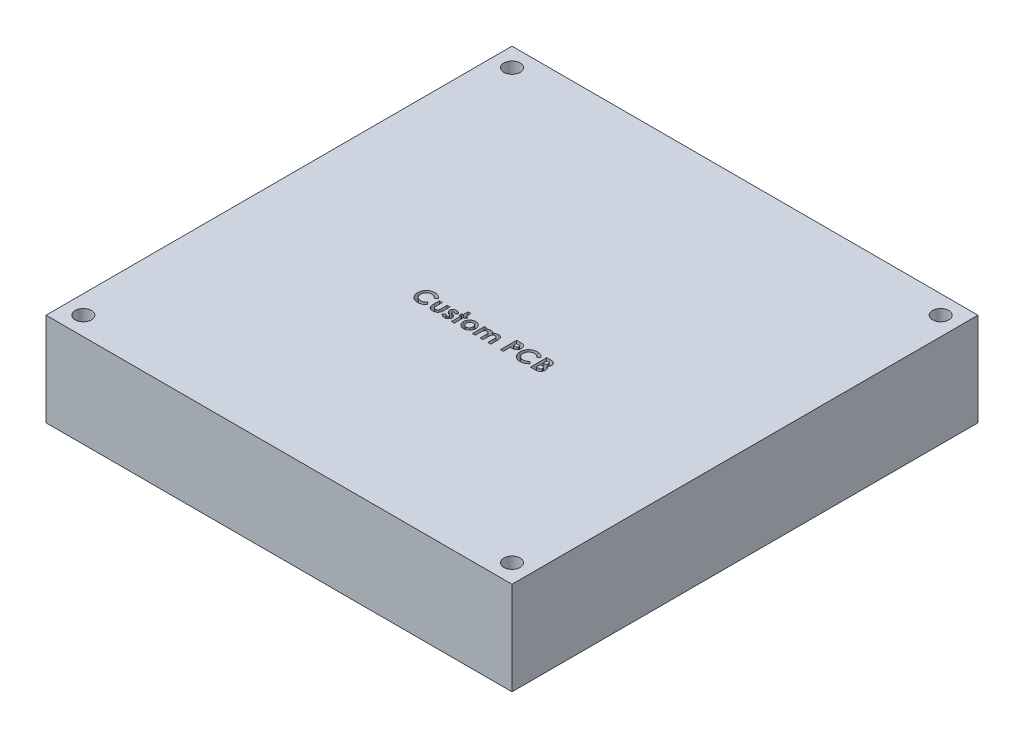
from build123d import *

# Parameters (mm, degrees)
SKETCH1_W           = 100
SKETCH1_H           = 100
SKETCH1_R           = 1.75
BOSS_EXTRUDE1_DEPTH = 20
CUT_EXTRUDE1_DEPTH  = 2


with BuildPart() as part:
    # Sketch1 → Boss-Extrude1 (new body)
    with BuildSketch(Plane(origin=(0, 0, 0), x_dir=(1, 0, 0), z_dir=(0, 1, 0))):
        with Locations((-50, 50)):
            Rectangle(SKETCH1_W, SKETCH1_H)
        with Locations(Location((-96, 96, 0), (0, 0, 270))):
            Circle(SKETCH1_R, mode=Mode.SUBTRACT)
        with Locations(Location((-96, 4, 0), (0, 0, 270))):
            Circle(SKETCH1_R, mode=Mode.SUBTRACT)
        with Locations(Location((-4, 4, 0), (0, 0, 270))):
            Circle(SKETCH1_R, mode=Mode.SUBTRACT)
        with Locations(Location((-4, 96, 0), (0, 0, 270))):
            Circle(SKETCH1_R, mode=Mode.SUBTRACT)
    extrude(amount=BOSS_EXTRUDE1_DEPTH)

    # Sketch2 → Cut-Extrude1 (cut)
    # profile 1 of 9: a face of its own
    with BuildSketch(Plane(origin=(0, 20, 0), x_dir=(1, 0, 0), z_dir=(0, 1, 0))):
        with BuildLine():
            Line((-60.993589744, 45.226903254), (-61.454226763, 44.786598767))
            add(Edge.make_bspline(
                [(-61.454226763, 44.786598767), (-61.493301748, 44.827002367), (-61.569627434, 44.905923255), (-61.692616839, 45.010407556), (-61.820521342, 45.097481083), (-61.950852817, 45.170813854), (-62.085955548, 45.226295321), (-62.22426738, 45.266725601), (-62.366671475, 45.291374414), (-62.46304509, 45.294194675), (-62.511518429, 45.29561319)],
                knots=[0, 0, 0, 0, 1.115251505, 2.178435587, 3.19620269, 4.182487026, 5.141301733, 6.088180966, 7.038406374, 8, 8, 8, 8], degree=3))
            add(Edge.make_bspline(
                [(-62.511518429, 45.29561319), (-62.551999559, 45.294492514), (-62.631884607, 45.292280982), (-62.749176792, 45.276068272), (-62.861372829, 45.248497852), (-62.968856782, 45.210500708), (-63.071312376, 45.161334419), (-63.168954421, 45.10103704), (-63.261542184, 45.030153142), (-63.347852636, 44.949049481), (-63.426806405, 44.860437636), (-63.496567086, 44.76588901), (-63.555002847, 44.665620206), (-63.602960125, 44.560646675), (-63.640316992, 44.450482547), (-63.666994487, 44.335201988), (-63.682424038, 44.214667709), (-63.684727002, 44.132729404), (-63.685897436, 44.091085947)],
                knots=[0, 0, 0, 0, 1.035432265, 2.043311493, 3.022114605, 3.98653278, 4.95457646, 5.923598177, 6.917315552, 7.932509744, 8.948865224, 9.949768934, 10.933144597, 11.912367597, 12.897413939, 13.903909035, 14.934704909, 16, 16, 16, 16], degree=3))
            add(Edge.make_bspline(
                [(-63.685897436, 44.091085947), (-63.68556013, 44.061857655), (-63.684895294, 44.004248091), (-63.677617482, 43.919027557), (-63.66589849, 43.836343492), (-63.648938205, 43.756321141), (-63.627729201, 43.678891154), (-63.602846211, 43.603385548), (-63.571630865, 43.530847641), (-63.536981361, 43.46043495), (-63.496684386, 43.394068776), (-63.453236814, 43.33078312), (-63.406125016, 43.270888204), (-63.355043845, 43.214628879), (-63.299274398, 43.162884353), (-63.240258109, 43.114098606), (-63.176999455, 43.069492911), (-63.110812477, 43.027947838), (-63.041125405, 42.99185728), (-62.969829011, 42.959166207), (-62.895842296, 42.932616196), (-62.820066094, 42.911214464), (-62.742771202, 42.893015488), (-62.663201605, 42.881809819), (-62.582047071, 42.873323896), (-62.527200228, 42.87279994), (-62.499599359, 42.872536267)],
                knots=[0, 0, 0, 0, 1.103660481, 2.175337485, 3.227646561, 4.255952547, 5.262355991, 6.258840057, 7.255597736, 8.242457506, 9.22035537, 10.185017736, 11.140346927, 12.096287581, 13.051739095, 14.01125915, 14.986044842, 15.97314143, 16.960198552, 17.947847494, 18.933482797, 19.925264591, 20.920966487, 21.929612487, 22.958107872, 24, 24, 24, 24], degree=3))
            add(Edge.make_bspline(
                [(-62.499599359, 42.872536267), (-62.452783542, 42.873890429), (-62.360802636, 42.876551005), (-62.22580743, 42.897356332), (-62.097170448, 42.931579918), (-61.994390115, 42.971995984), (-61.913864438, 43.011907373), (-61.852561431, 43.048823444), (-61.789169344, 43.090118121), (-61.724741065, 43.137349912), (-61.658551904, 43.189952016), (-61.591770252, 43.249076517), (-61.522686487, 43.31277653), (-61.477430398, 43.358240481), (-61.454226763, 43.38155069)],
                knots=[0, 0, 0, 0, 1.404581149, 2.759636711, 4.088442092, 5.392261763, 6.066678138, 6.783632037, 7.538459478, 8.336747902, 9.180226004, 10.074962426, 11.012997595, 12, 12, 12, 12], degree=3))
            Line((-61.454226763, 43.38155069), (-61.007612179, 42.912500209))
            add(Edge.make_bspline(
                [(-61.007612179, 42.912500209), (-61.039006781, 42.882189708), (-61.100282328, 42.82303009), (-61.192714791, 42.739028953), (-61.285030924, 42.663544594), (-61.375000561, 42.593837261), (-61.4640975, 42.531937697), (-61.552312291, 42.477784084), (-61.638646305, 42.430006797), (-61.724892294, 42.389411578), (-61.811586927, 42.35494202), (-61.900785516, 42.325265993), (-61.99276075, 42.300161143), (-62.088074372, 42.279904825), (-62.185837353, 42.263661993), (-62.286964627, 42.252698175), (-62.390814995, 42.245327565), (-62.461258309, 42.244665255), (-62.496794872, 42.244331139)],
                knots=[0, 0, 0, 0, 1.244526981, 2.429050516, 3.560637417, 4.644440555, 5.67424972, 6.652764056, 7.595344123, 8.486817594, 9.369275933, 10.254498637, 11.166417451, 12.086725134, 13.032340136, 13.991389299, 14.986715468, 16, 16, 16, 16], degree=3))
            add(Edge.make_bspline(
                [(-62.496794872, 42.244331139), (-62.562071136, 42.245995161), (-62.68979864, 42.24925119), (-62.876979966, 42.273376159), (-63.054797202, 42.313821244), (-63.223682943, 42.37102175), (-63.383583487, 42.444092716), (-63.534457927, 42.53367429), (-63.676063088, 42.639528466), (-63.807255077, 42.760414532), (-63.925924474, 42.893923043), (-64.03081448, 43.037274557), (-64.117579496, 43.191173595), (-64.189622358, 43.353346575), (-64.245958929, 43.524533556), (-64.285610324, 43.704919711), (-64.310063051, 43.894330865), (-64.312738214, 44.02370305), (-64.314102564, 44.089683703)],
                knots=[0, 0, 0, 0, 1.078019885, 2.10938526, 3.111377082, 4.085535484, 5.04941344, 6.010039228, 6.978205633, 7.964457913, 8.951525778, 9.924444315, 10.892603023, 11.863865945, 12.85144698, 13.863884204, 14.910567087, 16, 16, 16, 16], degree=3))
            add(Edge.make_bspline(
                [(-64.314102564, 44.089683703), (-64.313526056, 44.132715722), (-64.312383557, 44.217994667), (-64.30037579, 44.343617461), (-64.283636264, 44.466077216), (-64.257080528, 44.584102391), (-64.225070208, 44.699283006), (-64.185261169, 44.81036718), (-64.137716992, 44.91767418), (-64.083970137, 45.021383646), (-64.023166858, 45.120816169), (-63.955242921, 45.215117466), (-63.881946952, 45.305015527), (-63.801517769, 45.389317687), (-63.715124113, 45.468764136), (-63.622375927, 45.542924337), (-63.523831044, 45.612861832), (-63.419222741, 45.676773102), (-63.310583278, 45.734584243), (-63.199282884, 45.785576138), (-63.085595012, 45.82819362), (-62.970000344, 45.863543249), (-62.852010494, 45.889929248), (-62.732467644, 45.909902598), (-62.610354628, 45.921067828), (-62.528366316, 45.922895647), (-62.486979167, 45.923818318)],
                knots=[0, 0, 0, 0, 1.071919942, 2.124283339, 3.142214191, 4.149696895, 5.136002878, 6.119640489, 7.086990633, 8.058538607, 9.028339693, 9.988281803, 10.952401235, 11.916291999, 12.888973767, 13.874849856, 14.873389453, 15.898127285, 16.927174885, 17.938320013, 18.946391617, 19.950418109, 20.947802303, 21.956882652, 22.968648068, 24, 24, 24, 24], degree=3))
            add(Edge.make_bspline(
                [(-62.486979167, 45.923818318), (-62.451671684, 45.92328942), (-62.381423819, 45.922237123), (-62.276812961, 45.913465083), (-62.17303873, 45.899688682), (-62.070472672, 45.878903027), (-61.968381129, 45.854227828), (-61.868105698, 45.821919058), (-61.768064481, 45.785904845), (-61.669826474, 45.742857208), (-61.573254552, 45.695866823), (-61.480611065, 45.642554525), (-61.390340537, 45.586201094), (-61.304443309, 45.523471285), (-61.22131034, 45.456640426), (-61.141376341, 45.385396713), (-61.065342778, 45.308552305), (-61.017628335, 45.254257195), (-60.993589744, 45.226903254)],
                knots=[0, 0, 0, 0, 0.996412454, 1.982464992, 2.961075852, 3.949442424, 4.934965278, 5.923860011, 6.921385422, 7.934793307, 8.949617135, 9.951082467, 10.950285876, 11.951772932, 12.951063433, 13.960125323, 14.972308753, 16, 16, 16, 16], degree=3))
        make_face()
    # profile 2 of 9: a face of its own
    with BuildSketch(Plane(origin=(0, 20, 0), x_dir=(1, 0, 0), z_dir=(0, 1, 0))):
        with BuildLine():
            Line((-60.455128205, 44.891767036), (-59.826923077, 44.891767036))
            Line((-59.826923077, 44.891767036), (-59.826923077, 43.664102774))
            add(Edge.make_bspline(
                [(-59.826923077, 43.664102774), (-59.826867292, 43.63535384), (-59.826760227, 43.580177615), (-59.82378096, 43.500933755), (-59.819600458, 43.428468873), (-59.814383476, 43.362697521), (-59.806596795, 43.3037779), (-59.797607399, 43.251822489), (-59.787416326, 43.206456945), (-59.770844352, 43.155890997), (-59.744917201, 43.100556292), (-59.705762613, 43.041812004), (-59.658334987, 42.991015373), (-59.603275102, 42.947715602), (-59.540020661, 42.913594433), (-59.469443144, 42.890471036), (-59.392430561, 42.87492971), (-59.338791413, 42.873355108), (-59.310897436, 42.872536267)],
                knots=[0, 0, 0, 0, 1.267339619, 2.432334223, 3.495366327, 4.467371443, 5.340232306, 6.114347373, 6.791623365, 7.387877112, 8.457231658, 9.474542289, 10.487879852, 11.508108106, 12.54995813, 13.638205937, 14.771795776, 16, 16, 16, 16], degree=3))
            add(Edge.make_bspline(
                [(-59.310897436, 42.872536267), (-59.283028212, 42.873470858), (-59.229250344, 42.875274292), (-59.151725367, 42.889337949), (-59.080981613, 42.913436493), (-59.016292498, 42.946123324), (-58.959565709, 42.98986908), (-58.910176014, 43.041995252), (-58.86859105, 43.103342699), (-58.848607557, 43.149106136), (-58.838341346, 43.172616395)],
                knots=[0, 0, 0, 0, 1.116871431, 2.155171802, 3.144773418, 4.104381479, 5.046960687, 6.001340237, 6.973219418, 8, 8, 8, 8], degree=3))
            add(Edge.make_bspline(
                [(-58.838341346, 43.172616395), (-58.834573992, 43.183059863), (-58.826257991, 43.206112614), (-58.818856586, 43.245881782), (-58.81089047, 43.292783077), (-58.80458899, 43.347772307), (-58.80102339, 43.410508918), (-58.797203214, 43.481071982), (-58.795256384, 43.55939122), (-58.795003917, 43.614322379), (-58.794871795, 43.64306912)],
                knots=[0, 0, 0, 0, 0.56094539, 1.238222264, 2.041156151, 2.969685991, 4.036367568, 5.220421584, 6.545382566, 8, 8, 8, 8], degree=3))
            Line((-58.794871795, 43.64306912), (-58.794871795, 44.891767036))
            Line((-58.794871795, 44.891767036), (-58.166666667, 44.891767036))
            Line((-58.166666667, 44.891767036), (-58.166666667, 43.816947325))
            add(Edge.make_bspline(
                [(-58.166666667, 43.816947325), (-58.16677544, 43.763655484), (-58.166983991, 43.661478896), (-58.172960933, 43.514909901), (-58.181209792, 43.38164943), (-58.191832734, 43.261330575), (-58.207139081, 43.153903403), (-58.225928438, 43.059619834), (-58.246715466, 42.977856829), (-58.265777945, 42.929411684), (-58.274639423, 42.906891235)],
                knots=[0, 0, 0, 0, 1.388070971, 2.661352173, 3.82033814, 4.865898334, 5.806910977, 6.645039373, 7.370126333, 8, 8, 8, 8], degree=3))
            add(Edge.make_bspline(
                [(-58.274639423, 42.906891235), (-58.285997555, 42.882652274), (-58.308417533, 42.834806648), (-58.347320361, 42.766780764), (-58.389259789, 42.702331628), (-58.436231311, 42.642976309), (-58.487276092, 42.588111557), (-58.540951257, 42.536490162), (-58.599674056, 42.490214225), (-58.661921591, 42.448092935), (-58.728562438, 42.410702221), (-58.799140158, 42.377567716), (-58.874417454, 42.35060191), (-58.953741584, 42.327744586), (-59.037478178, 42.310698704), (-59.125458561, 42.297787749), (-59.217779225, 42.291115318), (-59.280740208, 42.28985084), (-59.313000801, 42.289202934)],
                knots=[0, 0, 0, 0, 0.997311338, 1.968606903, 2.91805772, 3.860812155, 4.785445165, 5.709667791, 6.633356648, 7.568312411, 8.508286151, 9.478643871, 10.470653671, 11.485274776, 12.552984541, 13.653035246, 14.797438149, 16, 16, 16, 16], degree=3))
            add(Edge.make_bspline(
                [(-59.313000801, 42.289202934), (-59.347851308, 42.28961826), (-59.416041931, 42.290430912), (-59.515667479, 42.300382718), (-59.610611965, 42.313259061), (-59.699815341, 42.335151205), (-59.784523373, 42.360514348), (-59.863763565, 42.392884465), (-59.937859711, 42.430942551), (-60.006957608, 42.474462976), (-60.070521355, 42.52384456), (-60.129964365, 42.576952733), (-60.183367561, 42.635900503), (-60.232474341, 42.698867539), (-60.276736645, 42.766433358), (-60.316176442, 42.838357715), (-60.35082714, 42.914967759), (-60.369315006, 42.968660462), (-60.378705929, 42.995933703)],
                knots=[0, 0, 0, 0, 1.211240017, 2.369985978, 3.478996442, 4.539426614, 5.559871561, 6.551301256, 7.510778031, 8.453136967, 9.386094087, 10.30661716, 11.221130616, 12.147659962, 13.080758632, 14.026335491, 14.997475882, 16, 16, 16, 16], degree=3))
            add(Edge.make_bspline(
                [(-60.378705929, 42.995933703), (-60.385112723, 43.017115146), (-60.398914451, 43.062744913), (-60.413816088, 43.13857626), (-60.42573496, 43.225976132), (-60.437329261, 43.325030502), (-60.445417658, 43.435905432), (-60.45070433, 43.558424839), (-60.454276371, 43.692828309), (-60.454835895, 43.786329199), (-60.455128205, 43.835176492)],
                knots=[0, 0, 0, 0, 0.627914866, 1.352675004, 2.190563461, 3.132055958, 4.183353232, 5.345633452, 6.613289997, 8, 8, 8, 8], degree=3))
            Line((-60.455128205, 43.835176492), (-60.455128205, 44.891767036))
        make_face()
    # profile 3 of 9: a face of its own
    with BuildSketch(Plane(origin=(0, 20, 0), x_dir=(1, 0, 0), z_dir=(0, 1, 0))):
        with BuildLine():
            Line((-55.967948718, 44.497035466), (-56.352163462, 44.084074729))
            add(Edge.make_bspline(
                [(-56.352163462, 44.084074729), (-56.371349144, 44.105304727), (-56.408044088, 44.145909671), (-56.4642205, 44.201263286), (-56.519560336, 44.247356495), (-56.573032341, 44.286076712), (-56.625728607, 44.31577049), (-56.677211107, 44.337134498), (-56.727504543, 44.350696688), (-56.760841159, 44.352452262), (-56.777043269, 44.353305498)],
                knots=[0, 0, 0, 0, 1.327646587, 2.539285, 3.655602211, 4.666613517, 5.598770349, 6.454635452, 7.248928967, 8, 8, 8, 8], degree=3))
            add(Edge.make_bspline(
                [(-56.777043269, 44.353305498), (-56.793438177, 44.352805837), (-56.824829326, 44.351849143), (-56.869129271, 44.343643102), (-56.908049736, 44.329436933), (-56.940983342, 44.310072601), (-56.967442785, 44.286217732), (-56.985968275, 44.258928325), (-56.998408311, 44.229053145), (-56.999460658, 44.20783165), (-57, 44.196955338)],
                knots=[0, 0, 0, 0, 1.295068245, 2.479652818, 3.543291146, 4.55379989, 5.481948265, 6.332409746, 7.145336708, 8, 8, 8, 8], degree=3))
            add(Edge.make_bspline(
                [(-57, 44.196955338), (-56.998172659, 44.180473024), (-56.994381138, 44.146274136), (-56.968338649, 44.106608529), (-56.933882556, 44.077348023), (-56.894164643, 44.050119442), (-56.840376307, 44.019674973), (-56.79957111, 43.998828756), (-56.777043269, 43.987319921)],
                knots=[0, 0, 0, 0, 0.916701701, 1.902049539, 2.5493345, 3.440293453, 4.586830489, 6, 6, 6, 6], degree=3))
            Line((-56.777043269, 43.987319921), (-56.549879808, 43.872335947))
            add(Edge.make_bspline(
                [(-56.549879808, 43.872335947), (-56.520980272, 43.857661701), (-56.464909744, 43.829190908), (-56.386079834, 43.783249461), (-56.313271273, 43.738719711), (-56.247944579, 43.693082732), (-56.18969991, 43.647131391), (-56.138950975, 43.60041129), (-56.094466858, 43.554403544), (-56.044860823, 43.492719735), (-55.995239899, 43.41056192), (-55.953871461, 43.303719509), (-55.92749131, 43.18931478), (-55.924572651, 43.110130905), (-55.923076923, 43.069551492)],
                knots=[0, 0, 0, 0, 1.076693506, 2.088987655, 3.030641824, 3.911722491, 4.735175175, 5.493635918, 6.202154166, 6.859459289, 8.120623445, 9.372284821, 10.653373066, 12, 12, 12, 12], degree=3))
            add(Edge.make_bspline(
                [(-55.923076923, 43.069551492), (-55.923978108, 43.042174894), (-55.925741967, 42.988591627), (-55.936892712, 42.909722167), (-55.956922337, 42.834728988), (-55.983281293, 42.762443096), (-56.018786016, 42.69417164), (-56.06189049, 42.629583664), (-56.111914079, 42.567831163), (-56.170179229, 42.511026569), (-56.234007725, 42.458085309), (-56.304963871, 42.413557908), (-56.379910293, 42.374408088), (-56.460826958, 42.343835565), (-56.546578504, 42.319049371), (-56.637899998, 42.30187316), (-56.734481569, 42.29106373), (-56.80061771, 42.289833732), (-56.834535256, 42.289202934)],
                knots=[0, 0, 0, 0, 0.976600749, 1.911466839, 2.833459288, 3.740827163, 4.650527853, 5.570709661, 6.506801416, 7.479409329, 8.468875524, 9.458587492, 10.461481786, 11.480119772, 12.538142914, 13.641687514, 14.790552763, 16, 16, 16, 16], degree=3))
            add(Edge.make_bspline(
                [(-56.834535256, 42.289202934), (-56.879473092, 42.290633954), (-56.967682108, 42.293442921), (-57.096504989, 42.313009785), (-57.218147989, 42.346880354), (-57.332711186, 42.39432869), (-57.440896264, 42.454790877), (-57.541158218, 42.529811216), (-57.635235181, 42.617435111), (-57.689970135, 42.684638557), (-57.717948718, 42.718990594)],
                knots=[0, 0, 0, 0, 1.056901255, 2.07460411, 3.05625841, 4.019970729, 4.984811261, 5.963335951, 6.958928997, 8, 8, 8, 8], degree=3))
            Line((-57.717948718, 42.718990594), (-57.337239583, 43.141767036))
            add(Edge.make_bspline(
                [(-57.337239583, 43.141767036), (-57.318690149, 43.122202153), (-57.281863454, 43.083359461), (-57.219788529, 43.032140119), (-57.154108861, 42.985457457), (-57.08409328, 42.946259253), (-57.014063552, 42.914608467), (-56.946875805, 42.89086595), (-56.883796268, 42.875945381), (-56.842783579, 42.873633553), (-56.823317308, 42.872536267)],
                knots=[0, 0, 0, 0, 1.087861918, 2.159761696, 3.243809206, 4.338405912, 5.394481878, 6.343674753, 7.213841449, 8, 8, 8, 8], degree=3))
            add(Edge.make_bspline(
                [(-56.823317308, 42.872536267), (-56.803861574, 42.873099718), (-56.766462283, 42.874182827), (-56.713308207, 42.885449281), (-56.6661953, 42.904389855), (-56.626241801, 42.930651441), (-56.593009549, 42.960795731), (-56.569593799, 42.995054893), (-56.554110065, 43.031382645), (-56.552228199, 43.056781626), (-56.551282051, 43.069551492)],
                knots=[0, 0, 0, 0, 1.255011871, 2.412479185, 3.488767498, 4.514443302, 5.48617286, 6.365347346, 7.178144445, 8, 8, 8, 8], degree=3))
            add(Edge.make_bspline(
                [(-56.551282051, 43.069551492), (-56.552126295, 43.081577008), (-56.553859691, 43.106267711), (-56.567583042, 43.142712956), (-56.589128973, 43.178799597), (-56.619012004, 43.214629377), (-56.657629767, 43.249911581), (-56.704844058, 43.28436361), (-56.759565642, 43.319823522), (-56.799986118, 43.340988341), (-56.821213942, 43.352103575)],
                knots=[0, 0, 0, 0, 0.704666567, 1.446816302, 2.258757648, 3.165368109, 4.175243826, 5.322435858, 6.59381024, 8, 8, 8, 8], degree=3))
            Line((-56.821213942, 43.352103575), (-57.029447115, 43.457271844))
            add(Edge.make_bspline(
                [(-57.029447115, 43.457271844), (-57.076682712, 43.48260146), (-57.167357346, 43.531224827), (-57.289915556, 43.614603567), (-57.393643388, 43.703361896), (-57.47862537, 43.797022972), (-57.546339183, 43.895323962), (-57.59357411, 43.999516427), (-57.623289193, 44.108612601), (-57.626558328, 44.183213748), (-57.628205128, 44.220793479)],
                knots=[0, 0, 0, 0, 1.255999728, 2.41104856, 3.467751088, 4.449286722, 5.368722015, 6.253902015, 7.120417131, 8, 8, 8, 8], degree=3))
            add(Edge.make_bspline(
                [(-57.628205128, 44.220793479), (-57.627634032, 44.245149128), (-57.626512876, 44.292963224), (-57.614577502, 44.363181538), (-57.596545713, 44.430679188), (-57.571100916, 44.495563367), (-57.538506576, 44.557898458), (-57.498572855, 44.617407821), (-57.450812564, 44.673983269), (-57.396754712, 44.72744256), (-57.336775829, 44.776130238), (-57.272589603, 44.819278905), (-57.204385884, 44.856033547), (-57.131604934, 44.885336962), (-57.055171839, 44.908660656), (-56.974582057, 44.92451444), (-56.890179423, 44.934597501), (-56.832461482, 44.935948747), (-56.802984776, 44.936638831)],
                knots=[0, 0, 0, 0, 0.959035663, 1.882742823, 2.798841253, 3.708806893, 4.623422363, 5.566085165, 6.527241613, 7.536786942, 8.55815439, 9.567237405, 10.580975912, 11.605536372, 12.654523293, 13.725718749, 14.838518481, 16, 16, 16, 16], degree=3))
            add(Edge.make_bspline(
                [(-56.802984776, 44.936638831), (-56.762233038, 44.935297116), (-56.681348027, 44.932634048), (-56.562058545, 44.911084484), (-56.446837278, 44.874864641), (-56.336007247, 44.824959754), (-56.230994071, 44.762243494), (-56.13410704, 44.686084773), (-56.044690458, 44.598358964), (-55.993783318, 44.531145353), (-55.967948718, 44.497035466)],
                knots=[0, 0, 0, 0, 0.996590028, 1.978055413, 2.954661574, 3.945146934, 4.945404762, 5.939399542, 6.954276554, 8, 8, 8, 8], degree=3))
        make_face()
    # profile 4 of 9: a face of its own
    with BuildSketch(Plane(origin=(0, 20, 0), x_dir=(1, 0, 0), z_dir=(0, 1, 0))):
        Polygon((-55.33974359, 45.923818318), (-54.711538462, 45.923818318), (-54.711538462, 44.891767036), (-54.307692308, 44.891767036), (-54.307692308, 44.353305498), (-54.711538462, 44.353305498), (-54.711538462, 42.334074729), (-55.33974359, 42.334074729), (-55.33974359, 44.353305498), (-55.653846154, 44.353305498), (-55.653846154, 44.891767036), (-55.33974359, 44.891767036), align=None)
    # profile 5 of 9: a face of its own
    with BuildSketch(Plane(origin=(0, 20, 0), x_dir=(1, 0, 0), z_dir=(0, 1, 0))):
        with BuildLine():
            add(Edge.make_bspline(
                [(-52.730168269, 44.936638831), (-52.700467944, 44.936110294), (-52.641647841, 44.93506355), (-52.554042646, 44.926350362), (-52.467968992, 44.912134437), (-52.382932138, 44.893727295), (-52.299721733, 44.867936137), (-52.217901346, 44.837003631), (-52.1367394, 44.801489496), (-52.058250319, 44.759215253), (-51.981867076, 44.713364982), (-51.909451216, 44.662788371), (-51.841604103, 44.607882682), (-51.777066263, 44.549920946), (-51.718845264, 44.4863797), (-51.663220471, 44.420320626), (-51.613197157, 44.349377058), (-51.566882773, 44.275277728), (-51.525649411, 44.198451137), (-51.489845819, 44.119431718), (-51.458771668, 44.039311971), (-51.43444123, 43.957115982), (-51.41429787, 43.873927614), (-51.401585978, 43.788727457), (-51.392548704, 43.70239073), (-51.391535339, 43.644261741), (-51.391025641, 43.615024248)],
                knots=[0, 0, 0, 0, 1.022364134, 2.024744242, 3.027414945, 4.024939316, 5.017584196, 6.023349371, 7.035562955, 8.064994934, 9.090267829, 10.101425541, 11.102933353, 12.093946398, 13.084502048, 14.067315274, 15.065326281, 16.070028806, 17.074376865, 18.064572984, 19.055292013, 20.030201733, 21.013838017, 21.999348303, 22.993720005, 24, 24, 24, 24], degree=3))
            add(Edge.make_bspline(
                [(-51.391025641, 43.615024248), (-51.391563543, 43.585558337), (-51.392633014, 43.526973428), (-51.40125902, 43.439824597), (-51.415529359, 43.354223783), (-51.434007148, 43.269666697), (-51.459701789, 43.187235328), (-51.489723234, 43.105714605), (-51.526575738, 43.026215686), (-51.567318898, 42.947871312), (-51.613931063, 42.87298692), (-51.663911076, 42.801332669), (-51.719302885, 42.734788387), (-51.777057809, 42.671290352), (-51.839915295, 42.612985782), (-51.90687202, 42.558927967), (-51.977348325, 42.508456025), (-52.051851009, 42.462754124), (-52.129425816, 42.422597493), (-52.208764463, 42.386393014), (-52.290330877, 42.356250199), (-52.373956253, 42.331669564), (-52.459691305, 42.312637394), (-52.547346755, 42.299708614), (-52.636733824, 42.290716797), (-52.696959311, 42.289710804), (-52.727363782, 42.289202934)],
                knots=[0, 0, 0, 0, 1.012026251, 2.012137606, 3.004615893, 3.992048833, 4.982446996, 5.968083444, 6.973977695, 7.990229942, 8.999482246, 10.001782172, 10.988562221, 11.971415814, 12.948383116, 13.930088534, 14.925840678, 15.924049238, 16.929462851, 17.924729459, 18.917889337, 19.913673841, 20.916777188, 21.931792057, 22.95587778, 24, 24, 24, 24], degree=3))
            add(Edge.make_bspline(
                [(-52.727363782, 42.289202934), (-52.771821319, 42.29050785), (-52.859447802, 42.29307986), (-52.988500893, 42.310697456), (-53.112478313, 42.341021958), (-53.231582081, 42.383293645), (-53.345966916, 42.437463236), (-53.454634557, 42.504506331), (-53.558665954, 42.583103044), (-53.656259202, 42.672589068), (-53.745667838, 42.770763339), (-53.823777039, 42.875563776), (-53.890098071, 42.985419595), (-53.944571266, 43.10045607), (-53.986613465, 43.220830946), (-54.016975105, 43.346184345), (-54.034614241, 43.476868616), (-54.037164498, 43.56565928), (-54.038461538, 43.610817517)],
                knots=[0, 0, 0, 0, 1.029999031, 2.030143771, 3.011211297, 3.982305373, 4.953580601, 5.938004764, 6.935448627, 7.970290061, 9.001484052, 10.007591832, 10.993831261, 11.969999897, 12.951306496, 13.942897864, 14.953773953, 16, 16, 16, 16], degree=3))
            add(Edge.make_bspline(
                [(-54.038461538, 43.610817517), (-54.037119266, 43.659036615), (-54.034481056, 43.753810286), (-54.013532512, 43.892655874), (-53.980079945, 44.025593944), (-53.932060894, 44.152252627), (-53.870720778, 44.272865526), (-53.795838399, 44.387178258), (-53.707043683, 44.495216713), (-53.63904471, 44.560562075), (-53.604467147, 44.593790274)],
                knots=[0, 0, 0, 0, 1.043912699, 2.05178951, 3.033892, 4.007821512, 4.978932272, 5.95884105, 6.962068106, 8, 8, 8, 8], degree=3))
            add(Edge.make_bspline(
                [(-53.604467147, 44.593790274), (-53.572738777, 44.621332713), (-53.510145271, 44.675668243), (-53.408451424, 44.744583956), (-53.3043284, 44.804106107), (-53.196528239, 44.853044386), (-53.084750423, 44.889943058), (-52.96956775, 44.916801991), (-52.85100417, 44.933299534), (-52.770651594, 44.935520076), (-52.730168269, 44.936638831)],
                knots=[0, 0, 0, 0, 1.048115528, 2.067714963, 3.060638214, 4.039924844, 5.017819947, 5.994373833, 6.98952318, 8, 8, 8, 8], degree=3))
        make_face()
        with BuildLine():
            add(Edge.make_bspline(
                [(-52.716145833, 44.353305498), (-52.740468212, 44.352497103), (-52.788347076, 44.350905768), (-52.858826022, 44.342365499), (-52.925485751, 44.324861483), (-52.989650251, 44.302601167), (-53.050184443, 44.27283113), (-53.108746145, 44.237993326), (-53.162290277, 44.194398101), (-53.21340801, 44.146577329), (-53.259811518, 44.093473645), (-53.299351713, 44.035617221), (-53.334681753, 43.975221522), (-53.361470731, 43.910075387), (-53.383641171, 43.841959449), (-53.398645859, 43.769773161), (-53.409088074, 43.694322884), (-53.409863261, 43.642638927), (-53.41025641, 43.616426492)],
                knots=[0, 0, 0, 0, 1.030650113, 2.02884584, 2.99876339, 3.944280128, 4.900564847, 5.851248946, 6.823638398, 7.81794922, 8.81432732, 9.802856497, 10.78262424, 11.771747962, 12.779760563, 13.812642396, 14.89064281, 16, 16, 16, 16], degree=3))
            add(Edge.make_bspline(
                [(-53.41025641, 43.616426492), (-53.409796372, 43.589289674), (-53.408897315, 43.536255975), (-53.399587393, 43.458819643), (-53.384235025, 43.385333078), (-53.362424121, 43.315909799), (-53.334993226, 43.250051496), (-53.3013387, 43.188127678), (-53.261105355, 43.130510668), (-53.215490508, 43.077271419), (-53.165544198, 43.028945563), (-53.110816937, 42.987474122), (-53.053600495, 42.951440944), (-52.992576296, 42.92250074), (-52.928611058, 42.900156555), (-52.861514895, 42.883705283), (-52.790935216, 42.874842135), (-52.742811029, 42.873315459), (-52.718249199, 42.872536267)],
                knots=[0, 0, 0, 0, 1.141730614, 2.231293227, 3.276944405, 4.297399982, 5.28939179, 6.275415646, 7.257752684, 8.24146775, 9.222424823, 10.176631434, 11.126518621, 12.063689483, 13.012557477, 13.974037417, 14.965980454, 16, 16, 16, 16], degree=3))
            add(Edge.make_bspline(
                [(-52.718249199, 42.872536267), (-52.693675084, 42.873227375), (-52.645495552, 42.874582347), (-52.57483299, 42.88472895), (-52.507394185, 42.900697703), (-52.442882634, 42.923234197), (-52.381819919, 42.95279385), (-52.323972287, 42.988999416), (-52.268830845, 43.031047688), (-52.218214251, 43.08028536), (-52.171359438, 43.133690644), (-52.13027057, 43.19161181), (-52.095935161, 43.253535644), (-52.067773979, 43.319072521), (-52.045920318, 43.388132362), (-52.030822111, 43.460971853), (-52.020374313, 43.537365258), (-52.019616658, 43.589747278), (-52.019230769, 43.616426492)],
                knots=[0, 0, 0, 0, 1.031504075, 2.022346795, 2.991027682, 3.937587355, 4.885570121, 5.833146507, 6.798790848, 7.791235734, 8.792807298, 9.778388351, 10.766749885, 11.760164525, 12.768777521, 13.802286646, 14.880660483, 16, 16, 16, 16], degree=3))
            add(Edge.make_bspline(
                [(-52.019230769, 43.616426492), (-52.01969666, 43.643096381), (-52.020610889, 43.695431355), (-52.029921474, 43.771928082), (-52.045123179, 43.844532135), (-52.067215395, 43.912933501), (-52.094483244, 43.977912532), (-52.128161033, 44.039136623), (-52.168592795, 44.096304231), (-52.214429389, 44.149131887), (-52.265124425, 44.196779621), (-52.318901489, 44.239269833), (-52.376990298, 44.274412503), (-52.43830107, 44.303382608), (-52.502996923, 44.325670968), (-52.571005227, 44.342215474), (-52.642534406, 44.350952503), (-52.691352248, 44.352512969), (-52.716145833, 44.353305498)],
                knots=[0, 0, 0, 0, 1.123894411, 2.205445421, 3.243160173, 4.246488011, 5.231014757, 6.210004299, 7.185865357, 8.177612767, 9.153374344, 10.115157457, 11.061423229, 12.009021698, 12.96873347, 13.94135618, 14.954456845, 16, 16, 16, 16], degree=3))
        make_face(mode=Mode.SUBTRACT)
    # profile 6 of 9: a face of its own
    with BuildSketch(Plane(origin=(0, 20, 0), x_dir=(1, 0, 0), z_dir=(0, 1, 0))):
        with BuildLine():
            Line((-50.852564103, 44.891767036), (-50.224358974, 44.891767036))
            Line((-50.224358974, 44.891767036), (-50.224358974, 44.586077934))
            add(Edge.make_bspline(
                [(-50.224358974, 44.586077934), (-50.196416729, 44.614279689), (-50.141400746, 44.669806626), (-50.050228499, 44.741191496), (-49.955126613, 44.80223438), (-49.854942605, 44.851652435), (-49.74992152, 44.88938669), (-49.640561103, 44.917037795), (-49.526299635, 44.933351081), (-49.448503018, 44.935530766), (-49.408954327, 44.936638831)],
                knots=[0, 0, 0, 0, 1.041528618, 2.050684245, 3.032913108, 4.004406485, 4.976926473, 5.95771665, 6.961784757, 8, 8, 8, 8], degree=3))
            add(Edge.make_bspline(
                [(-49.408954327, 44.936638831), (-49.369353418, 44.935393206), (-49.291400309, 44.932941234), (-49.177667265, 44.910503388), (-49.069923377, 44.874049471), (-48.969354082, 44.822088892), (-48.875232523, 44.757920277), (-48.791728347, 44.678228474), (-48.716564553, 44.58618584), (-48.676499358, 44.516600619), (-48.655949519, 44.480909665)],
                knots=[0, 0, 0, 0, 1.023965777, 2.015643508, 2.987309376, 3.958410333, 4.93654923, 5.924956801, 6.93568961, 8, 8, 8, 8], degree=3))
            add(Edge.make_bspline(
                [(-48.655949519, 44.480909665), (-48.629478671, 44.516697713), (-48.577523825, 44.586939608), (-48.485429127, 44.678648366), (-48.385847283, 44.757928586), (-48.276851611, 44.822562629), (-48.161336661, 44.873872113), (-48.03980791, 44.910367942), (-47.913367179, 44.932903734), (-47.827317323, 44.935383456), (-47.783754006, 44.936638831)],
                knots=[0, 0, 0, 0, 1.041189987, 2.043563759, 3.033412161, 4.015238574, 5.00275396, 5.986226558, 6.980513695, 8, 8, 8, 8], degree=3))
            add(Edge.make_bspline(
                [(-47.783754006, 44.936638831), (-47.738758274, 44.935335317), (-47.651133267, 44.932796845), (-47.524152049, 44.90782272), (-47.405218773, 44.86923395), (-47.29696183, 44.813077845), (-47.199072462, 44.746558715), (-47.115658911, 44.667963587), (-47.046433285, 44.580034981), (-47.001358526, 44.497931118), (-46.972218905, 44.4253419), (-46.954624143, 44.36217568), (-46.938167597, 44.291642606), (-46.926345215, 44.212794614), (-46.915309543, 44.126372815), (-46.908902902, 44.031802648), (-46.904548241, 43.929402696), (-46.904085721, 43.858552728), (-46.903846154, 43.821855177)],
                knots=[0, 0, 0, 0, 1.321991808, 2.574456155, 3.791773975, 4.987670122, 6.148905103, 7.262530793, 8.344737981, 9.427709016, 10.004683293, 10.642050061, 11.354108788, 12.133887687, 12.985666279, 13.916212488, 14.92067847, 16, 16, 16, 16], degree=3))
            Line((-46.903846154, 43.821855177), (-46.903846154, 42.334074729))
            Line((-46.903846154, 42.334074729), (-47.532051282, 42.334074729))
            Line((-47.532051282, 42.334074729), (-47.532051282, 43.618529857))
            add(Edge.make_bspline(
                [(-47.532051282, 43.618529857), (-47.532574144, 43.652886644), (-47.53357773, 43.718831392), (-47.53784436, 43.813416544), (-47.547394904, 43.899197113), (-47.558589366, 43.976648246), (-47.574608857, 44.045359287), (-47.594141716, 44.105495872), (-47.616799715, 44.157144566), (-47.644158566, 44.200299987), (-47.674800511, 44.236643667), (-47.708885254, 44.267797399), (-47.74605741, 44.294377697), (-47.786653999, 44.317033624), (-47.831738548, 44.332356275), (-47.879789073, 44.344378975), (-47.931181585, 44.352566519), (-47.966714356, 44.353054636), (-47.984975962, 44.353305498)],
                knots=[0, 0, 0, 0, 1.669139205, 3.203761885, 4.596586177, 5.860166715, 7.002923539, 8.018877315, 8.928339525, 9.734594377, 10.491888885, 11.231098709, 11.971440889, 12.708030942, 13.480072485, 14.275788656, 15.113863979, 16, 16, 16, 16], degree=3))
            add(Edge.make_bspline(
                [(-47.984975962, 44.353305498), (-48.013116838, 44.352332595), (-48.068337707, 44.350423466), (-48.148805769, 44.332179605), (-48.224526809, 44.302352844), (-48.295217143, 44.261776177), (-48.359355673, 44.211096687), (-48.415460651, 44.15098598), (-48.461795539, 44.081097632), (-48.493869678, 44.016255265), (-48.513911985, 43.957624735), (-48.528050012, 43.907412394), (-48.539070042, 43.850629665), (-48.547695498, 43.787851623), (-48.555970617, 43.718723379), (-48.560030344, 43.643332348), (-48.564184683, 43.561783266), (-48.564130602, 43.505422359), (-48.564102564, 43.476202133)],
                knots=[0, 0, 0, 0, 1.129913425, 2.217230253, 3.297175357, 4.391411011, 5.481605898, 6.571841268, 7.681894157, 8.841607612, 9.468549532, 10.170608623, 10.93710061, 11.791434153, 12.717934886, 13.734733707, 14.825576123, 16, 16, 16, 16], degree=3))
            Line((-48.564102564, 43.476202133), (-48.564102564, 42.334074729))
            Line((-48.564102564, 42.334074729), (-49.192307692, 42.334074729))
            Line((-49.192307692, 42.334074729), (-49.192307692, 43.560336748))
            add(Edge.make_bspline(
                [(-49.192307692, 43.560336748), (-49.192360437, 43.587684006), (-49.192461899, 43.640291271), (-49.195511672, 43.716257169), (-49.199550167, 43.786401258), (-49.205211667, 43.850919182), (-49.211741091, 43.909730698), (-49.221164556, 43.962514064), (-49.231064775, 44.009560134), (-49.248038835, 44.063003066), (-49.271957468, 44.122226778), (-49.307692254, 44.185030227), (-49.350900493, 44.237613315), (-49.400490096, 44.28038525), (-49.456528476, 44.312974032), (-49.517596005, 44.337216036), (-49.584858731, 44.350301125), (-49.631157894, 44.352282907), (-49.655048077, 44.353305498)],
                knots=[0, 0, 0, 0, 1.256487322, 2.417074606, 3.49288742, 4.484586665, 5.393016842, 6.210437544, 6.947749329, 7.599905853, 8.784490193, 9.876739139, 10.906602197, 11.896672079, 12.869113195, 13.872201355, 14.902064413, 16, 16, 16, 16], degree=3))
            add(Edge.make_bspline(
                [(-49.655048077, 44.353305498), (-49.682041928, 44.35238928), (-49.735503476, 44.350574702), (-49.813378387, 44.331084655), (-49.887834025, 44.30180516), (-49.95723244, 44.260096749), (-50.020404719, 44.208224616), (-50.075947967, 44.14640411), (-50.122039347, 44.074708561), (-50.154255857, 44.008077608), (-50.174005924, 43.947984328), (-50.188524102, 43.896468177), (-50.199134116, 43.838434963), (-50.207986534, 43.774536298), (-50.216212661, 43.704696755), (-50.220289186, 43.628609207), (-50.22443942, 43.546357992), (-50.224386436, 43.489530132), (-50.224358974, 43.460076331)],
                knots=[0, 0, 0, 0, 1.07893236, 2.136834559, 3.195274846, 4.273923004, 5.364443877, 6.458052972, 7.587287137, 8.767908, 9.410170275, 10.118584836, 10.909717261, 11.770069756, 12.702352573, 13.724628867, 14.820678298, 16, 16, 16, 16], degree=3))
            Line((-50.224358974, 43.460076331), (-50.224358974, 42.334074729))
            Line((-50.224358974, 42.334074729), (-50.852564103, 42.334074729))
            Line((-50.852564103, 42.334074729), (-50.852564103, 44.891767036))
        make_face()
    # profile 7 of 9: a face of its own
    with BuildSketch(Plane(origin=(0, 20, 0), x_dir=(1, 0, 0), z_dir=(0, 1, 0))):
        with BuildLine():
            Line((-44.83974359, 45.834074729), (-44.138621795, 45.834074729))
            add(Edge.make_bspline(
                [(-44.138621795, 45.834074729), (-44.092811406, 45.833869672), (-44.004433564, 45.833474074), (-43.876985445, 45.828676921), (-43.759408315, 45.820080132), (-43.651729187, 45.80945586), (-43.553992336, 45.794561044), (-43.466075367, 45.777485304), (-43.387960034, 45.756682083), (-43.318765471, 45.731988947), (-43.256665586, 45.702876706), (-43.197899065, 45.67187009), (-43.143794039, 45.634864788), (-43.091619664, 45.595849073), (-43.044358838, 45.55109579), (-42.999063148, 45.503583335), (-42.957650991, 45.451427402), (-42.919930477, 45.395259325), (-42.885712159, 45.336116851), (-42.855816747, 45.273894249), (-42.831567263, 45.208493059), (-42.811224961, 45.140336352), (-42.794885826, 45.069427099), (-42.784009978, 44.995329202), (-42.776622554, 44.91856004), (-42.775970716, 44.8663109), (-42.775641026, 44.839884024)],
                knots=[0, 0, 0, 0, 1.698747864, 3.27724071, 4.728299578, 6.070144658, 7.288476769, 8.393259625, 9.389771311, 10.283485332, 11.113357557, 11.931608583, 12.74405601, 13.541433047, 14.344816069, 15.154114104, 15.974336324, 16.810834471, 17.661136416, 18.50621059, 19.367396281, 20.244825668, 21.142564693, 22.063065223, 23.020325768, 24, 24, 24, 24], degree=3))
            add(Edge.make_bspline(
                [(-42.775641026, 44.839884024), (-42.776118047, 44.810648599), (-42.777055451, 44.753197398), (-42.786245037, 44.668980985), (-42.801943754, 44.588688261), (-42.822461156, 44.511642101), (-42.851071214, 44.439110087), (-42.883756861, 44.369361582), (-42.923970575, 44.30435212), (-42.969921172, 44.24326851), (-43.020104466, 44.185614116), (-43.075711806, 44.133053597), (-43.135683293, 44.085228651), (-43.199671773, 44.041638069), (-43.267917479, 44.002369783), (-43.340371166, 43.967056086), (-43.417527591, 43.93682642), (-43.471257004, 43.92101655), (-43.498497596, 43.913001011)],
                knots=[0, 0, 0, 0, 1.102006807, 2.165578795, 3.188629044, 4.184801286, 5.166646146, 6.124351954, 7.085497154, 8.042432466, 9.003981491, 9.963833307, 10.922997304, 11.89326795, 12.880200226, 13.889073926, 14.929769137, 16, 16, 16, 16], degree=3))
            add(Edge.make_bspline(
                [(-43.498497596, 43.913001011), (-43.516439817, 43.908536957), (-43.555308445, 43.89886638), (-43.619625349, 43.889048316), (-43.693743828, 43.88002121), (-43.777903555, 43.872263506), (-43.872153051, 43.866990074), (-43.976401057, 43.862871759), (-44.090694817, 43.859877318), (-44.170170178, 43.859771062), (-44.211538462, 43.859715754)],
                knots=[0, 0, 0, 0, 0.618981996, 1.340914327, 2.176866532, 3.120127938, 4.170906482, 5.338178032, 6.614476169, 8, 8, 8, 8], degree=3))
            Line((-44.211538462, 43.859715754), (-44.211538462, 42.334074729))
            Line((-44.211538462, 42.334074729), (-44.83974359, 42.334074729))
            Line((-44.83974359, 42.334074729), (-44.83974359, 45.834074729))
        make_face()
        with BuildLine():
            Line((-44.211538462, 44.487920883), (-43.989282853, 44.487920883))
            add(Edge.make_bspline(
                [(-43.989282853, 44.487920883), (-43.948839936, 44.488177322), (-43.874424368, 44.488649175), (-43.77279898, 44.495472435), (-43.691130864, 44.505892933), (-43.626611536, 44.520838336), (-43.575667415, 44.543519965), (-43.5317313, 44.569758338), (-43.494046173, 44.602936041), (-43.4614164, 44.640847243), (-43.435329879, 44.684409114), (-43.417240236, 44.732912334), (-43.405489559, 44.785337798), (-43.404404275, 44.821822451), (-43.403846154, 44.840585145)],
                knots=[0, 0, 0, 0, 1.8619151, 3.425951444, 4.686033666, 5.651700536, 6.461346321, 7.243864085, 7.999046032, 8.762387399, 9.539336099, 10.322741239, 11.137448474, 12, 12, 12, 12], degree=3))
            add(Edge.make_bspline(
                [(-43.403846154, 44.840585145), (-43.404398534, 44.856977867), (-43.405470284, 44.888783688), (-43.413343652, 44.934687377), (-43.425891536, 44.977479085), (-43.444072937, 45.016711909), (-43.467577184, 45.052319185), (-43.496233617, 45.084286888), (-43.529674519, 45.113299633), (-43.55549285, 45.128656521), (-43.568609776, 45.136458543)],
                knots=[0, 0, 0, 0, 1.102301479, 2.1387299, 3.123554645, 4.094223062, 5.036071848, 5.982632524, 6.975082478, 8, 8, 8, 8], degree=3))
            add(Edge.make_bspline(
                [(-43.568609776, 45.136458543), (-43.579720569, 45.14207759), (-43.603244396, 45.153974263), (-43.643307753, 45.167805016), (-43.689540256, 45.17947278), (-43.742254026, 45.189156911), (-43.801238771, 45.196672803), (-43.86648397, 45.20242058), (-43.938085635, 45.204731985), (-43.987880309, 45.205479936), (-44.013822115, 45.205869601)],
                knots=[0, 0, 0, 0, 0.656809284, 1.390599849, 2.23162475, 3.173112763, 4.218524733, 5.370385145, 6.63003504, 8, 8, 8, 8], degree=3))
            Line((-44.013822115, 45.205869601), (-44.211538462, 45.205869601))
            Line((-44.211538462, 45.205869601), (-44.211538462, 44.487920883))
        make_face(mode=Mode.SUBTRACT)
    # profile 8 of 9: a face of its own
    with BuildSketch(Plane(origin=(0, 20, 0), x_dir=(1, 0, 0), z_dir=(0, 1, 0))):
        with BuildLine():
            Line((-39.006410256, 45.226903254), (-39.467047276, 44.786598767))
            add(Edge.make_bspline(
                [(-39.467047276, 44.786598767), (-39.50612226, 44.827002367), (-39.582447947, 44.905923255), (-39.705437352, 45.010407556), (-39.833341855, 45.097481083), (-39.96367333, 45.170813854), (-40.098776061, 45.226295321), (-40.237087893, 45.266725601), (-40.379491988, 45.291374414), (-40.475865603, 45.294194675), (-40.524338942, 45.29561319)],
                knots=[0, 0, 0, 0, 1.115251505, 2.178435587, 3.19620269, 4.182487026, 5.141301733, 6.088180966, 7.038406374, 8, 8, 8, 8], degree=3))
            add(Edge.make_bspline(
                [(-40.524338942, 45.29561319), (-40.564820072, 45.294492514), (-40.64470512, 45.292280982), (-40.761997305, 45.276068272), (-40.874193342, 45.248497852), (-40.981677295, 45.210500708), (-41.084132888, 45.161334419), (-41.181774933, 45.10103704), (-41.274362697, 45.030153142), (-41.360673149, 44.949049481), (-41.439626917, 44.860437636), (-41.509387599, 44.76588901), (-41.56782336, 44.665620206), (-41.615780638, 44.560646675), (-41.653137504, 44.450482547), (-41.679815, 44.335201988), (-41.695244551, 44.214667709), (-41.697547515, 44.132729404), (-41.698717949, 44.091085947)],
                knots=[0, 0, 0, 0, 1.035432265, 2.043311493, 3.022114605, 3.98653278, 4.95457646, 5.923598177, 6.917315552, 7.932509744, 8.948865224, 9.949768934, 10.933144597, 11.912367597, 12.897413939, 13.903909035, 14.934704909, 16, 16, 16, 16], degree=3))
            add(Edge.make_bspline(
                [(-41.698717949, 44.091085947), (-41.698380643, 44.061857655), (-41.697715806, 44.004248091), (-41.690437995, 43.919027557), (-41.678719003, 43.836343492), (-41.661758717, 43.756321141), (-41.640549714, 43.678891154), (-41.615666724, 43.603385548), (-41.584451378, 43.530847641), (-41.549801874, 43.46043495), (-41.509504899, 43.394068776), (-41.466057327, 43.33078312), (-41.418945529, 43.270888204), (-41.367864358, 43.214628879), (-41.312094911, 43.162884353), (-41.253078622, 43.114098606), (-41.189819967, 43.069492911), (-41.12363299, 43.027947838), (-41.053945918, 42.99185728), (-40.982649523, 42.959166207), (-40.908662809, 42.932616196), (-40.832886607, 42.911214464), (-40.755591715, 42.893015488), (-40.676022118, 42.881809819), (-40.594867584, 42.873323896), (-40.540020741, 42.87279994), (-40.512419872, 42.872536267)],
                knots=[0, 0, 0, 0, 1.103660481, 2.175337485, 3.227646561, 4.255952547, 5.262355991, 6.258840057, 7.255597736, 8.242457506, 9.22035537, 10.185017736, 11.140346927, 12.096287581, 13.051739095, 14.01125915, 14.986044842, 15.97314143, 16.960198552, 17.947847494, 18.933482797, 19.925264591, 20.920966487, 21.929612487, 22.958107872, 24, 24, 24, 24], degree=3))
            add(Edge.make_bspline(
                [(-40.512419872, 42.872536267), (-40.465604055, 42.873890429), (-40.373623149, 42.876551005), (-40.238627943, 42.897356332), (-40.109990961, 42.931579918), (-40.007210627, 42.971995984), (-39.926684951, 43.011907373), (-39.865381944, 43.048823444), (-39.801989857, 43.090118121), (-39.737561578, 43.137349912), (-39.671372417, 43.189952016), (-39.604590765, 43.249076517), (-39.535507, 43.31277653), (-39.490250911, 43.358240481), (-39.467047276, 43.38155069)],
                knots=[0, 0, 0, 0, 1.404581149, 2.759636711, 4.088442092, 5.392261763, 6.066678138, 6.783632037, 7.538459478, 8.336747902, 9.180226004, 10.074962426, 11.012997595, 12, 12, 12, 12], degree=3))
            Line((-39.467047276, 43.38155069), (-39.020432692, 42.912500209))
            add(Edge.make_bspline(
                [(-39.020432692, 42.912500209), (-39.051827294, 42.882189708), (-39.113102841, 42.82303009), (-39.205535304, 42.739028953), (-39.297851437, 42.663544594), (-39.387821074, 42.593837261), (-39.476918013, 42.531937697), (-39.565132804, 42.477784084), (-39.651466817, 42.430006797), (-39.737712807, 42.389411578), (-39.82440744, 42.35494202), (-39.913606029, 42.325265993), (-40.005581263, 42.300161143), (-40.100894884, 42.279904825), (-40.198657866, 42.263661993), (-40.29978514, 42.252698175), (-40.403635508, 42.245327565), (-40.474078822, 42.244665255), (-40.509615385, 42.244331139)],
                knots=[0, 0, 0, 0, 1.244526981, 2.429050516, 3.560637417, 4.644440555, 5.67424972, 6.652764056, 7.595344123, 8.486817594, 9.369275933, 10.254498637, 11.166417451, 12.086725134, 13.032340136, 13.991389299, 14.986715468, 16, 16, 16, 16], degree=3))
            add(Edge.make_bspline(
                [(-40.509615385, 42.244331139), (-40.574891649, 42.245995161), (-40.702619152, 42.24925119), (-40.889800479, 42.273376159), (-41.067617715, 42.313821244), (-41.236503456, 42.37102175), (-41.396404, 42.444092716), (-41.54727844, 42.53367429), (-41.6888836, 42.639528466), (-41.820075589, 42.760414532), (-41.938744987, 42.893923043), (-42.043634992, 43.037274557), (-42.130400009, 43.191173595), (-42.202442871, 43.353346575), (-42.258779442, 43.524533556), (-42.298430837, 43.704919711), (-42.322883563, 43.894330865), (-42.325558726, 44.02370305), (-42.326923077, 44.089683703)],
                knots=[0, 0, 0, 0, 1.078019885, 2.10938526, 3.111377082, 4.085535484, 5.04941344, 6.010039228, 6.978205633, 7.964457913, 8.951525778, 9.924444315, 10.892603023, 11.863865945, 12.85144698, 13.863884204, 14.910567087, 16, 16, 16, 16], degree=3))
            add(Edge.make_bspline(
                [(-42.326923077, 44.089683703), (-42.326346569, 44.132715722), (-42.32520407, 44.217994667), (-42.313196302, 44.343617461), (-42.296456777, 44.466077216), (-42.269901041, 44.584102391), (-42.23789072, 44.699283006), (-42.198081681, 44.81036718), (-42.150537504, 44.91767418), (-42.09679065, 45.021383646), (-42.035987371, 45.120816169), (-41.968063434, 45.215117466), (-41.894767465, 45.305015527), (-41.814338282, 45.389317687), (-41.727944626, 45.468764136), (-41.63519644, 45.542924337), (-41.536651557, 45.612861832), (-41.432043254, 45.676773102), (-41.323403791, 45.734584243), (-41.212103397, 45.785576138), (-41.098415525, 45.82819362), (-40.982820857, 45.863543249), (-40.864831007, 45.889929248), (-40.745288157, 45.909902598), (-40.623175141, 45.921067828), (-40.541186829, 45.922895647), (-40.499799679, 45.923818318)],
                knots=[0, 0, 0, 0, 1.071919942, 2.124283339, 3.142214191, 4.149696895, 5.136002878, 6.119640489, 7.086990633, 8.058538607, 9.028339693, 9.988281803, 10.952401235, 11.916291999, 12.888973767, 13.874849856, 14.873389453, 15.898127285, 16.927174885, 17.938320013, 18.946391617, 19.950418109, 20.947802303, 21.956882652, 22.968648068, 24, 24, 24, 24], degree=3))
            add(Edge.make_bspline(
                [(-40.499799679, 45.923818318), (-40.464492197, 45.92328942), (-40.394244332, 45.922237123), (-40.289633473, 45.913465083), (-40.185859243, 45.899688682), (-40.083293185, 45.878903027), (-39.981201642, 45.854227828), (-39.880926211, 45.821919058), (-39.780884993, 45.785904845), (-39.682646987, 45.742857208), (-39.586075065, 45.695866823), (-39.493431578, 45.642554525), (-39.40316105, 45.586201094), (-39.317263822, 45.523471285), (-39.234130853, 45.456640426), (-39.154196853, 45.385396713), (-39.078163291, 45.308552305), (-39.030448848, 45.254257195), (-39.006410256, 45.226903254)],
                knots=[0, 0, 0, 0, 0.996412454, 1.982464992, 2.961075852, 3.949442424, 4.934965278, 5.923860011, 6.921385422, 7.934793307, 8.949617135, 9.951082467, 10.950285876, 11.951772932, 12.951063433, 13.960125323, 14.972308753, 16, 16, 16, 16], degree=3))
        make_face()
    # profile 9 of 9: a face of its own
    with BuildSketch(Plane(origin=(0, 20, 0), x_dir=(1, 0, 0), z_dir=(0, 1, 0))):
        with BuildLine():
            Line((-38.378205128, 42.334074729), (-38.378205128, 45.834074729))
            Line((-38.378205128, 45.834074729), (-37.817307692, 45.834074729))
            add(Edge.make_bspline(
                [(-37.817307692, 45.834074729), (-37.778041365, 45.83407921), (-37.702061765, 45.834087881), (-37.592443032, 45.830238431), (-37.490780914, 45.825258736), (-37.397398941, 45.819687616), (-37.312138169, 45.810087462), (-37.235128251, 45.799969948), (-37.166215321, 45.787768851), (-37.123610201, 45.776824088), (-37.103565705, 45.771674889)],
                knots=[0, 0, 0, 0, 1.311965854, 2.538629056, 3.664479157, 4.713267157, 5.663616078, 6.530575999, 7.308677837, 8, 8, 8, 8], degree=3))
            add(Edge.make_bspline(
                [(-37.103565705, 45.771674889), (-37.077245247, 45.764411852), (-37.025596058, 45.750159441), (-36.951617937, 45.721376082), (-36.881439369, 45.689381337), (-36.815146042, 45.652881317), (-36.753145022, 45.611435365), (-36.695671935, 45.564714552), (-36.641487228, 45.514594251), (-36.592514876, 45.459677623), (-36.548251938, 45.401648032), (-36.509795382, 45.340520685), (-36.476381563, 45.277230258), (-36.449641756, 45.210980283), (-36.429493813, 45.142075859), (-36.414757693, 45.070811219), (-36.405206691, 44.996960864), (-36.404304246, 44.946718053), (-36.403846154, 44.921214152)],
                knots=[0, 0, 0, 0, 1.099996261, 2.158545794, 3.195537121, 4.207578794, 5.205712374, 6.197378256, 7.190519799, 8.17788031, 9.159561366, 10.129234751, 11.085776129, 12.040971148, 13.00380137, 13.975669004, 14.972423361, 16, 16, 16, 16], degree=3))
            add(Edge.make_bspline(
                [(-36.403846154, 44.921214152), (-36.40504393, 44.888448333), (-36.407401604, 44.823952844), (-36.422462588, 44.72922064), (-36.45070428, 44.63968509), (-36.487657847, 44.55369609), (-36.537903145, 44.471574377), (-36.601704956, 44.393358999), (-36.678029899, 44.316641588), (-36.736575344, 44.270654675), (-36.767027244, 44.246734985)],
                knots=[0, 0, 0, 0, 0.986156485, 1.941127874, 2.875419072, 3.804401753, 4.751181392, 5.761612777, 6.835722519, 8, 8, 8, 8], degree=3))
            add(Edge.make_bspline(
                [(-36.767027244, 44.246734985), (-36.742350485, 44.234137714), (-36.693966189, 44.20943795), (-36.625274702, 44.168838912), (-36.561673884, 44.125656686), (-36.502878567, 44.080760115), (-36.450122051, 44.03224597), (-36.401225931, 43.982909702), (-36.358602486, 43.929924547), (-36.320487317, 43.875178998), (-36.287358232, 43.817880332), (-36.258506452, 43.758125315), (-36.234136389, 43.69570981), (-36.213499188, 43.630951462), (-36.198107959, 43.563627531), (-36.18807255, 43.493713941), (-36.180388814, 43.421449131), (-36.179791091, 43.372224148), (-36.179487179, 43.347195722)],
                knots=[0, 0, 0, 0, 1.164658916, 2.283573913, 3.35186032, 4.395461096, 5.390182219, 6.362969632, 7.312859996, 8.245001507, 9.165155236, 10.092416118, 11.032087915, 11.979892451, 12.947605196, 13.931445124, 14.948243989, 16, 16, 16, 16], degree=3))
            add(Edge.make_bspline(
                [(-36.179487179, 43.347195722), (-36.181459364, 43.29939286), (-36.185351462, 43.205054103), (-36.213808583, 43.066543142), (-36.263144188, 42.935222187), (-36.329391732, 42.811613166), (-36.411021453, 42.699294355), (-36.504872224, 42.600904052), (-36.609999182, 42.517618845), (-36.706991506, 42.461407791), (-36.790882229, 42.423684918), (-36.860367347, 42.400362258), (-36.934992892, 42.378756182), (-37.016125822, 42.363583949), (-37.102295311, 42.349696653), (-37.194341514, 42.341122349), (-37.2920924, 42.335311754), (-37.359231934, 42.334495407), (-37.393830128, 42.334074729)],
                knots=[0, 0, 0, 0, 1.284142165, 2.534249414, 3.780121997, 5.041676246, 6.291546858, 7.49970053, 8.684500223, 9.883330709, 10.50184324, 11.153274765, 11.851151195, 12.587658647, 13.369265475, 14.195992086, 15.070362669, 16, 16, 16, 16], degree=3))
            Line((-37.393830128, 42.334074729), (-38.378205128, 42.334074729))
        make_face()
        with BuildLine():
            Line((-37.75, 45.205869601), (-37.75, 44.443049088))
            Line((-37.75, 44.443049088), (-37.583133013, 44.443049088))
            add(Edge.make_bspline(
                [(-37.583133013, 44.443049088), (-37.56045429, 44.443246855), (-37.516674388, 44.443628632), (-37.453438964, 44.448545791), (-37.394640231, 44.45693477), (-37.340501202, 44.468639506), (-37.29051755, 44.483502814), (-37.245008586, 44.501386575), (-37.204174405, 44.523206707), (-37.156734531, 44.555708756), (-37.106587163, 44.603536977), (-37.062443, 44.672634751), (-37.036442382, 44.752096929), (-37.033546614, 44.808139809), (-37.032051282, 44.837079536)],
                knots=[0, 0, 0, 0, 1.065314748, 2.056525647, 2.977365736, 3.853934255, 4.656397591, 5.425096493, 6.14721249, 6.826394842, 8.123232004, 9.372140726, 10.643011755, 12, 12, 12, 12], degree=3))
            add(Edge.make_bspline(
                [(-37.032051282, 44.837079536), (-37.033247822, 44.864186399), (-37.035561283, 44.916596429), (-37.061740562, 44.990184778), (-37.102402158, 45.055399116), (-37.150408887, 45.100032997), (-37.195616551, 45.130516622), (-37.234326127, 45.150588791), (-37.276812794, 45.168557192), (-37.323899047, 45.182296269), (-37.375315999, 45.192605588), (-37.430813888, 45.200176549), (-37.490488468, 45.205329667), (-37.531705828, 45.205685762), (-37.552984776, 45.205869601)],
                knots=[0, 0, 0, 0, 1.347982417, 2.606269829, 3.849316587, 5.153353503, 5.842674298, 6.568177932, 7.326619318, 8.142485038, 9.012069166, 9.942760135, 10.937925643, 12, 12, 12, 12], degree=3))
            Line((-37.552984776, 45.205869601), (-37.75, 45.205869601))
        make_face(mode=Mode.SUBTRACT)
        with BuildLine():
            Line((-37.75, 43.859715754), (-37.75, 42.962279857))
            Line((-37.75, 42.962279857), (-37.569110577, 42.962279857))
            add(Edge.make_bspline(
                [(-37.569110577, 42.962279857), (-37.533348508, 42.962484164), (-37.464591467, 42.962876971), (-37.366097128, 42.967623006), (-37.27654115, 42.976176899), (-37.196160823, 42.986855746), (-37.12483303, 43.001323912), (-37.062798874, 43.019718332), (-37.009207638, 43.039955397), (-36.964380659, 43.064950576), (-36.927759584, 43.094038765), (-36.894712904, 43.123767594), (-36.8677687, 43.158062606), (-36.846449943, 43.195451612), (-36.827998597, 43.235005842), (-36.816870048, 43.278269875), (-36.808397161, 43.323961469), (-36.807930875, 43.355565356), (-36.807692308, 43.371734985)],
                knots=[0, 0, 0, 0, 1.753078804, 3.370512758, 4.83203934, 6.162291463, 7.344201807, 8.395507345, 9.331626367, 10.147333109, 10.898971645, 11.62040215, 12.321813352, 13.025280112, 13.727906689, 14.453419512, 15.208716525, 16, 16, 16, 16], degree=3))
            add(Edge.make_bspline(
                [(-36.807692308, 43.371734985), (-36.808218418, 43.390225211), (-36.809243139, 43.426239196), (-36.817612049, 43.47887748), (-36.832821092, 43.52801881), (-36.851977625, 43.574919796), (-36.878634957, 43.617901221), (-36.910316285, 43.658450508), (-36.948595418, 43.695194534), (-36.991642535, 43.730355713), (-37.041852736, 43.761141231), (-37.099249577, 43.787853121), (-37.16414487, 43.810161907), (-37.236739633, 43.827924178), (-37.316715618, 43.842998771), (-37.404656562, 43.851999968), (-37.49983006, 43.858694553), (-37.565824914, 43.859367619), (-37.599959936, 43.859715754)],
                knots=[0, 0, 0, 0, 0.845221588, 1.646264278, 2.427170338, 3.19324141, 3.95557735, 4.731569926, 5.540061037, 6.376114724, 7.268642756, 8.224665384, 9.265483498, 10.400594375, 11.639216012, 12.983232105, 14.439614077, 16, 16, 16, 16], degree=3))
            Line((-37.599959936, 43.859715754), (-37.75, 43.859715754))
        make_face(mode=Mode.SUBTRACT)
    extrude(amount=-CUT_EXTRUDE1_DEPTH, mode=Mode.SUBTRACT)


solid = part.part
